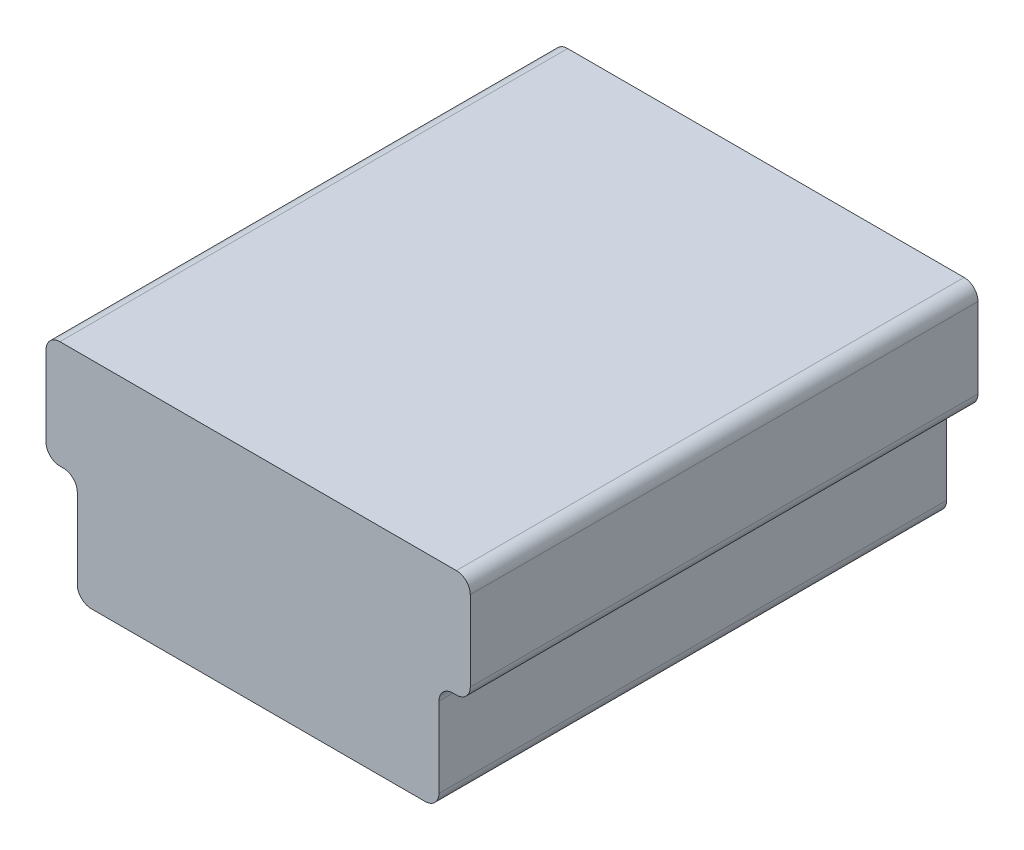
from build123d import *

# Parameters (mm, degrees)
SKETCH1_W           = 7.747
SKETCH1_H           = 9.271
BOSS_EXTRUDE1_DEPTH = 3.937
SKETCH2_W           = 0.5715
SKETCH2_H           = 1.9685
CUT_EXTRUDE1_DEPTH  = 11.791450887
SKETCH3_W           = 0.5715
SKETCH3_H           = 1.9685
CUT_EXTRUDE2_DEPTH  = 11.791450887
CUT_EXTRUDE3_DEPTH  = 8.89
SKETCH5_W           = 4.445
SKETCH5_H           = 1.524
BOSS_EXTRUDE2_DEPTH = 8.001
CHAMFER1_SIZE       = 0.508000102
FILLET1_R           = 0.254


with BuildPart() as part:
    # Sketch1 → Boss-Extrude1 (new body)
    with BuildSketch(Plane.XZ):
        with Locations((0, 4.6355)):
            Rectangle(SKETCH1_W, SKETCH1_H)
    extrude(amount=-BOSS_EXTRUDE1_DEPTH)

    # Sketch2 → Cut-Extrude1 (cut, through all)
    with BuildSketch(Plane(origin=(0, 0, 0), x_dir=(-1, 0, 0), z_dir=(0, 0, -1))):
        with Locations((-3.58775, 0.98425)):
            Rectangle(SKETCH2_W, SKETCH2_H)
    extrude(amount=-CUT_EXTRUDE1_DEPTH, mode=Mode.SUBTRACT)

    # Sketch3 → Cut-Extrude2 (cut, through all)
    with BuildSketch(Plane(origin=(0, 0, 0), x_dir=(-1, 0, 0), z_dir=(0, 0, -1))):
        with Locations((3.58775, 0.98425)):
            Rectangle(SKETCH3_W, SKETCH3_H)
    extrude(amount=-CUT_EXTRUDE2_DEPTH, mode=Mode.SUBTRACT)

    # Sketch4 → Cut-Extrude3 (cut)
    with BuildSketch(Plane(origin=(0, 0, 0), x_dir=(-1, 0, 0), z_dir=(0, 0, -1))):
        with BuildLine():
            Line((3.4925, 2.346317023), (3.4925, 3.556))
            Line((3.4925, 3.556), (-3.4925, 3.556))
            Line((-3.4925, 3.556), (-3.4925, 2.346317023))
            ThreePointArc((-3.4925, 2.346317023), (-3.085071396, 2.14047095), (-2.921, 1.7145))
            Line((-2.921, 1.7145), (-2.921, 0.381))
            Line((-2.921, 0.381), (2.921, 0.381))
            Line((2.921, 0.381), (2.921, 1.7145))
            ThreePointArc((2.921, 1.7145), (3.085071396, 2.14047095), (3.4925, 2.346317023))
        make_face()
    extrude(amount=-CUT_EXTRUDE3_DEPTH, mode=Mode.SUBTRACT)

    # Sketch5 → Boss-Extrude2 (add)
    with BuildSketch(Plane(origin=(0, 0, 8.89), x_dir=(-1, 0, 0), z_dir=(0, 0, -1))):
        with Locations((0, 1.778)):
            Rectangle(SKETCH5_W, SKETCH5_H)
    extrude(amount=BOSS_EXTRUDE2_DEPTH)

    # Chamfer1
    chamfer1_edges = [part.edges().sort_by_distance(p)[0] for p in [
        (2.2225, 1.016, 4.8895),
        (-2.2225, 1.016, 4.8895),
    ]]
    chamfer(chamfer1_edges, length=CHAMFER1_SIZE)

    # Fillet1
    fillet1_edges = [part.edges().sort_by_distance(p)[0] for p in [
        (3.8735, 3.937, 4.6355),
        (3.302, 0, 4.6355),
        (3.8735, 1.9685, 4.6355),
        (3.302, 1.9685, 4.6355),
        (-3.8735, 1.9685, 4.6355),
        (-3.302, 0, 4.6355),
        (-3.302, 1.9685, 4.6355),
        (-3.8735, 3.937, 4.6355),
    ]]
    fillet(fillet1_edges, radius=FILLET1_R)


solid = part.part
